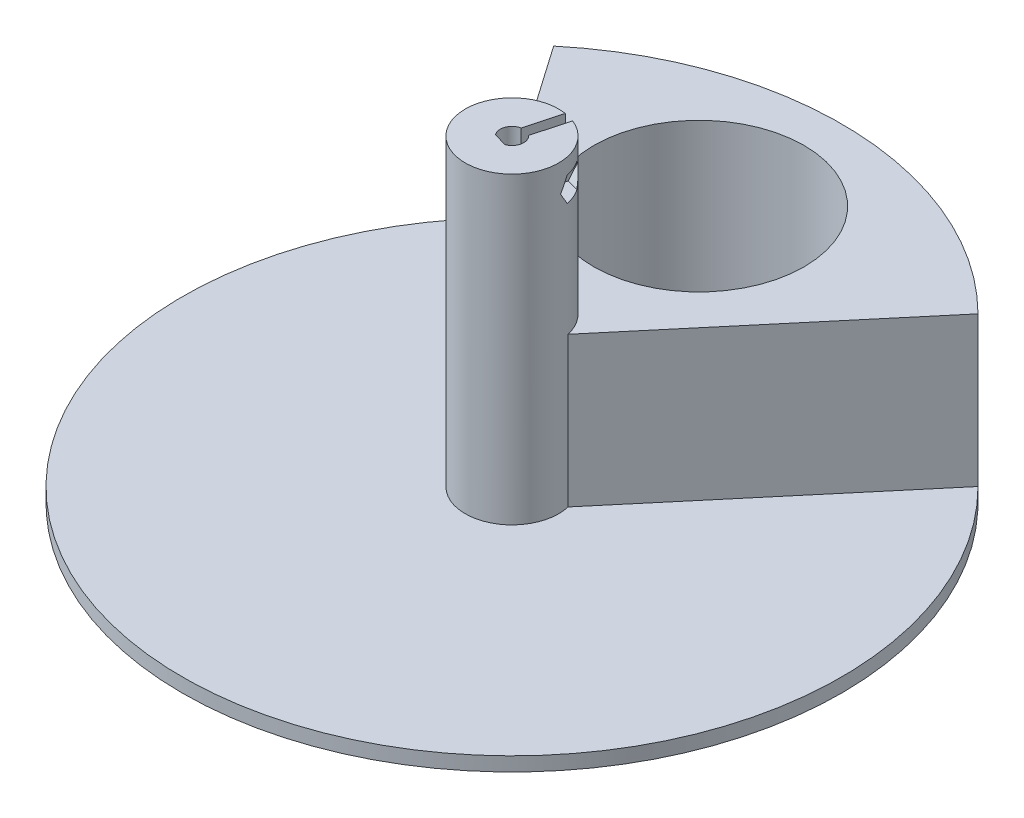
from build123d import *
from build123d.topology import SkipClean

# Parameters (mm, degrees)
SKETCH3_R               = 70.5
BOSS_EXTRUDE2_DEPTH     = 38
SKETCH4_R               = 22.5
CUT_EXTRUDE1_DEPTH      = 89
CUT_EXTRUDE2_START      = -35
CUT_EXTRUDE2_DEPTH      = 35
SKETCH8_R               = 10
BOSS_EXTRUDE3_DEPTH     = 65
CUT_EXTRUDE4_DEPTH      = 30
CUT_EXTRUDE5_START      = -3
CUT_EXTRUDE5_DEPTH      = 3
CUT_EXTRUDE6_START      = -10
CUT_EXTRUDE6_DEPTH      = 10
CUT_EXTRUDE7_DEPTH      = 20
CUT_EXTRUDE9_DEPTH      = 12
CUT_EXTRUDE9_DEPTH_BACK = 12
SKETCH14_R              = 1.55
CUT_EXTRUDE10_DEPTH     = 7
SKETCH16_R              = 3.05
CUT_EXTRUDE11_DEPTH     = 7


with BuildPart() as part:
    # Sketch3 → Boss-Extrude2 (new body)
    with BuildSketch(Plane(origin=(0, 0, 0), x_dir=(1, 0, 0), z_dir=(0, 1, 0))):
        Circle(SKETCH3_R)
    extrude(amount=BOSS_EXTRUDE2_DEPTH)

    # Sketch4 → Cut-Extrude1 (cut)
    with BuildSketch(Plane(origin=(0, 38, 0), x_dir=(1, 0, 0), z_dir=(0, 1, 0))):
        with Locations((0, 40)):
            Circle(SKETCH4_R)
        with BuildLine():
            Line((1.445129752, -2.04), (-1.445129752, -2.04))
            ThreePointArc((-1.445129752, -2.04), (0, 2.5), (1.445129752, -2.04))
        make_face()
    extrude(amount=-CUT_EXTRUDE1_DEPTH, mode=Mode.SUBTRACT)

    # Sketch6 → Cut-Extrude2 (cut)
    with BuildSketch(Plane(origin=(0, 38, 0), x_dir=(1, 0, 0), z_dir=(0, 1, 0)).offset(CUT_EXTRUDE2_START)):
        with BuildLine():
            Line((-45.196231291, 54.106845011), (-0.557111742, -9.984469265))
            Line((-0.557111742, -9.984469265), (49.803768709, 49.898242679))
            ThreePointArc((49.803768709, 49.898242679), (-3.120165646, -70.430920527), (-45.196231291, 54.106845011))
        make_face()
    extrude(amount=CUT_EXTRUDE2_DEPTH, mode=Mode.SUBTRACT)

    # Sketch8 → Boss-Extrude3 (add)
    with BuildSketch(Plane(origin=(0, 3, 0), x_dir=(1, 0, 0), z_dir=(0, 1, 0))):
        Circle(SKETCH8_R)
    extrude(amount=BOSS_EXTRUDE3_DEPTH)

    # Sketch10 → Cut-Extrude4 (cut)
    with BuildSketch(Plane(origin=(0, 68, 0), x_dir=(1, 0, 0), z_dir=(0, 1, 0))):
        with BuildLine():
            Line((-1.99989737, -1.516743389), (0.826538727, -2.370007117))
            ThreePointArc((0.826538727, -2.370007117), (0.725401526, 2.402892554), (-1.99989737, -1.516743389))
        make_face()
    extrude(amount=-CUT_EXTRUDE4_DEPTH, mode=Mode.SUBTRACT)

    # Sketch11 → Cut-Extrude5 (cut)
    with SkipClean():  # the faces are left unmerged after this step: merging them gives an invalid solid
        with BuildSketch(Plane(origin=(0, 38, 0), x_dir=(1, 0, 0), z_dir=(0, 1, 0)).offset(CUT_EXTRUDE5_START)):
            with BuildLine():
                Line((-45.196231291, 54.106845011), (-9.558315606, 2.939150008))
                ThreePointArc((-9.558315606, 2.939150008), (0.351258268, 9.993828977), (9.741081782, 2.260824122))
                Line((9.741081782, 2.260824122), (49.803768709, 49.898242679))
                ThreePointArc((49.803768709, 49.898242679), (3.120165646, 70.430920527), (-45.196231291, 54.106845011))
            make_face()
        extrude(amount=CUT_EXTRUDE5_DEPTH, mode=Mode.SUBTRACT)

    # Sketch12 → Cut-Extrude6 (cut)
    with SkipClean():  # the faces are left unmerged after this step: merging them gives an invalid solid
        with BuildSketch(Plane.XZ.offset(-3).offset(CUT_EXTRUDE6_START)):
            with BuildLine():
                Line((-1.445129752, 2.04), (1.445129752, 2.04))
                ThreePointArc((1.445129752, 2.04), (0, -2.5), (-1.445129752, 2.04))
            make_face()
        extrude(amount=CUT_EXTRUDE6_DEPTH, mode=Mode.SUBTRACT)

    # Sketch13 → Cut-Extrude7 (cut)
    with SkipClean():  # the faces are left unmerged after this step: merging them gives an invalid solid
        with BuildSketch(Plane(origin=(0, 68, 0), x_dir=(1, 0, 0), z_dir=(0, 1, 0))):
            Polygon((-0.496518118, 2.460400325), (1.674568679, 1.86973788), (3.774701815, 9.5891576), (1.603615019, 10.179820045), align=None)
        extrude(amount=-CUT_EXTRUDE7_DEPTH, mode=Mode.SUBTRACT)

    # Sketch14 → Cut-Extrude9 (cut, two sides: drawn at the far end of the back side and taken through both)
    with SkipClean():  # the faces are left unmerged after this step: merging them gives an invalid solid
        with BuildSketch(Plane(origin=(-1.085543398, 0, -0.295331222), x_dir=(0.2625166420985644, 0, -0.9649274649533479), z_dir=(0.9649274649533479, 0, 0.2625166420985644)).offset(-CUT_EXTRUDE9_DEPTH_BACK)):
            with Locations((6.057727773, 62)):
                Circle(SKETCH14_R)
        extrude(amount=CUT_EXTRUDE9_DEPTH + CUT_EXTRUDE9_DEPTH_BACK, mode=Mode.SUBTRACT)

    # Sketch15 → Cut-Extrude10 (cut)
    with SkipClean():  # the faces are left unmerged after this step: merging them gives an invalid solid
        with BuildSketch(Plane(origin=(10.493586181, 0, 2.854868483), x_dir=(0.2625166420985644, 0, -0.9649274649533479), z_dir=(0.9649274649533479, 0, 0.2625166420985644))):
            Polygon((9.107727773, 62), (7.582727773, 64.641377482), (4.532727773, 64.641377482), (3.007727773, 62), (4.532727773, 59.358622518), (7.582727773, 59.358622518), align=None)
        extrude(amount=-CUT_EXTRUDE10_DEPTH, mode=Mode.SUBTRACT)

    # Sketch16 → Cut-Extrude11 (cut)
    with SkipClean():  # the faces are left unmerged after this step: merging them gives an invalid solid
        with BuildSketch(Plane(origin=(-10.493586181, 0, -2.854868483), x_dir=(-0.26251664209856435, 0, 0.9649274649533478), z_dir=(-0.9649274649533478, 0, -0.26251664209856435))):
            with Locations((-6.057727773, 62)):
                Circle(SKETCH16_R)
        extrude(amount=-CUT_EXTRUDE11_DEPTH, mode=Mode.SUBTRACT)


solid = part.part
